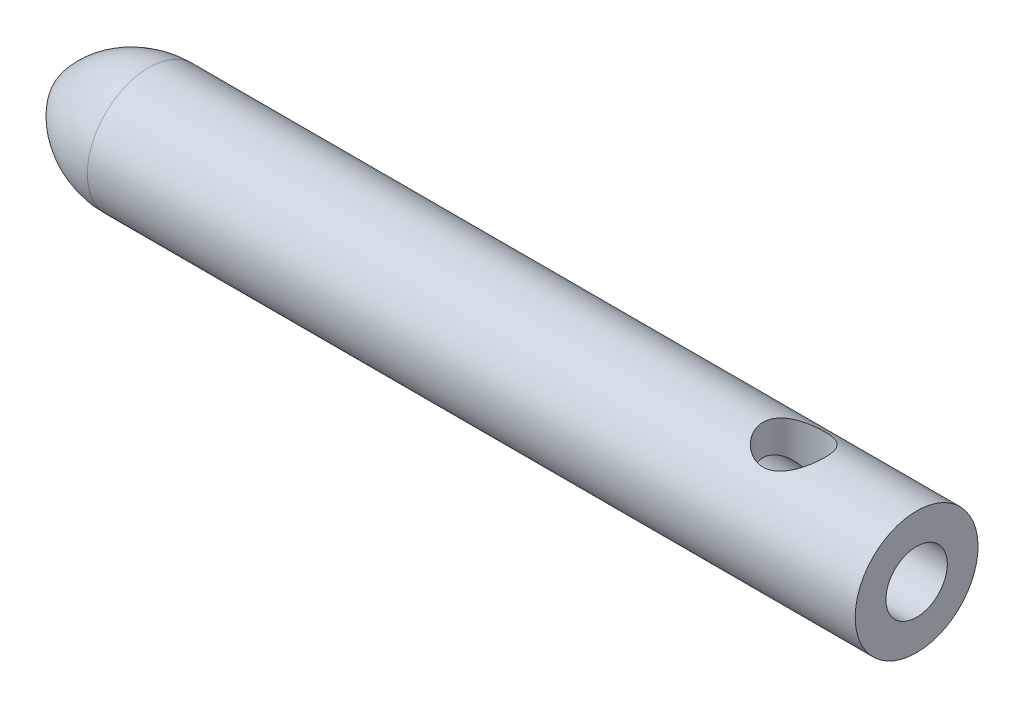
from build123d import *

# Parameters (mm, degrees)
SKETCH4_R          = 1
CUT_EXTRUDE1_DEPTH = 2
SKETCH5_R          = 1
CUT_EXTRUDE2_DEPTH = 10


with BuildPart() as part:
    # Sketch1 → Revolve1 (revolve)
    with BuildSketch(Plane.XY, mode=Mode.PRIVATE) as revolve1_sk:
        with BuildLine():
            Line((0, 0.8346352), (25, 0.8346352))
            Line((25, 0.8346352), (25, -1.1653648))
            Line((25, -1.1653648), (-3, -1.1653648))
            ThreePointArc((-3, -1.1653648), (-1.802775638, 0.288798657), (0, 0.8346352))
        make_face()
    revolve(revolve1_sk.sketch.rotate(Axis((-3, -1.1653648, 0), (1, 0, 0)), 180), axis=Axis((-3, -1.1653648, 0), (1, 0, 0)))

    # Sketch4 → Cut-Extrude1 (cut)
    with BuildSketch(Plane(origin=(0, 0.8346352, 0), x_dir=(1, 0, 0), z_dir=(0, 1, 0))):
        with Locations(Location((21, 0, 0), (0, 0, 180))):
            Circle(SKETCH4_R)
    extrude(amount=-CUT_EXTRUDE1_DEPTH, mode=Mode.SUBTRACT)

    # Sketch5 → Cut-Extrude2 (cut)
    with BuildSketch(Plane(origin=(25, 0, 0), x_dir=(0, 0, -1), z_dir=(1, 0, 0))):
        with Locations(Location((0, -1.1653648, 0), (0, 0, 90))):
            Circle(SKETCH5_R)
    extrude(amount=-CUT_EXTRUDE2_DEPTH, mode=Mode.SUBTRACT)


solid = part.part
